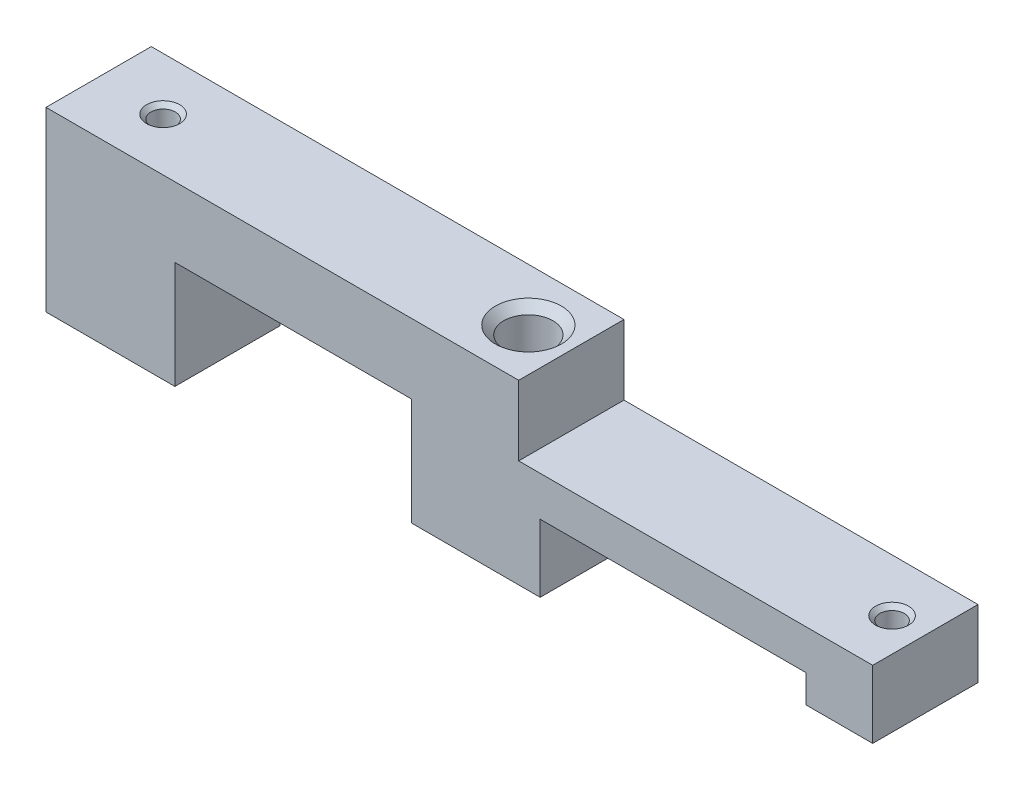
from build123d import *

# Parameters (mm, degrees)
BOSS_EXTRUDE1_DEPTH = 12.446
SKETCH2_R           = 1.450000021
SKETCH2_R_2         = 2.900000042
CUT_EXTRUDE1_DEPTH  = 100.851652202
CHAMFER2_SIZE       = 0.5
CHAMFER3_SIZE       = 1


with BuildPart() as part:
    # Sketch1 → Boss-Extrude1 (new body)
    with BuildSketch(Plane.XY):
        Polygon((0, 8.001), (-41.850200018, 8.001), (-41.850200018, 16.256), (-57.090200018, 16.256), (-82.490200018, 16.256), (-97.730200018, 16.256), (-97.730200018, 8.001), (-97.730200018, -4.699), (-82.490200018, -4.699), (-82.490200018, 8.001), (-54.550200018, 8.001), (-54.550200018, -4.699), (-39.310200018, -4.699), (-39.310200018, 3.302), (-7.874, 3.302), (-7.874, 0), (0, 0), align=None)
    extrude(amount=BOSS_EXTRUDE1_DEPTH)

    # Sketch2 → Cut-Extrude1 (cut, through all)
    with BuildSketch(Plane.XZ):
        with Locations(Location((-90.110200018, 6.223, 0), (0, 0, 270))):
            Circle(SKETCH2_R)
        with Locations(Location((-46.930200018, 6.223, 0), (0, 0, 270))):
            Circle(SKETCH2_R_2)
        with Locations(Location((-3.937, 6.223, 0), (0, 0, 270))):
            Circle(SKETCH2_R)
    extrude(amount=-CUT_EXTRUDE1_DEPTH, mode=Mode.SUBTRACT)

    # Chamfer2
    chamfer2_edges = [part.edges().sort_by_distance(p)[0] for p in [
        (-90.110200018, 16.256, 7.673000021),
        (-3.937, 8.001, 7.673000021),
    ]]
    chamfer(chamfer2_edges, length=CHAMFER2_SIZE)

    # Chamfer3
    chamfer3_edges = [part.edges().sort_by_distance(p)[0] for p in [
        (-46.930200018, 16.256, 9.123000042),
    ]]
    chamfer(chamfer3_edges, length=CHAMFER3_SIZE)


solid = part.part
